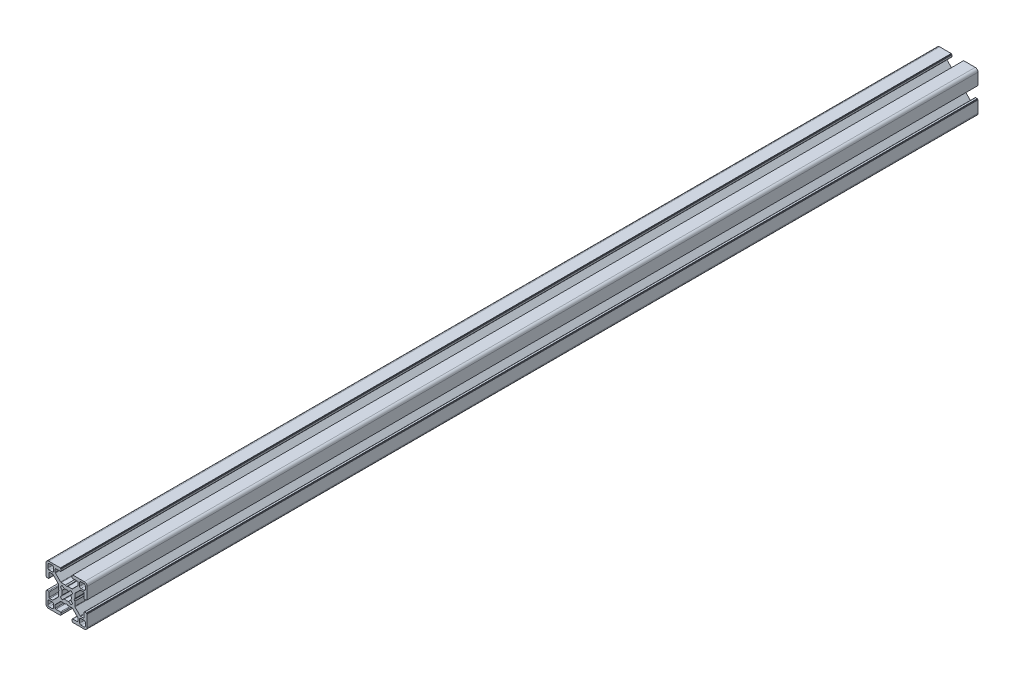
from build123d import *

# Parameters (mm, degrees)
BOSS_EXTRUDE1_DEPTH = 325
CIRPATTERN1_COUNT   = 4


with BuildPart() as part:
    # Sketch3 → Boss-Extrude1 (new, symmetric)
    with BuildSketch(Plane.XY):
        with BuildLine():
            Line((-4.503841895, 3.156803476), (-3.14772708, 1.530298739))
            ThreePointArc((-3.14772708, 1.530298739), (-3.410794979, 0.785160882), (-3.5, 0))
            Line((-3.5, 0), (-5.5, 0))
            Line((-5.5, 0), (-6, 0.866025404))
            Line((-6, 0.866025404), (-6, 3.996841995))
            ThreePointArc((-6, 3.996841995), (-6.038060234, 4.188183711), (-6.146446609, 4.350395385))
            Line((-6.146446609, 4.350395385), (-9.917104615, 8.121053391))
            ThreePointArc((-9.917104615, 8.121053391), (-10.079316289, 8.229439766), (-10.270658005, 8.2675))
            Line((-10.270658005, 8.2675), (-12.29, 8.2675))
            ThreePointArc((-12.29, 8.2675), (-12.643553391, 8.121053391), (-12.79, 7.7675))
            Line((-12.79, 7.7675), (-12.79, 4.5))
            ThreePointArc((-12.79, 4.5), (-12.936446609, 4.146446609), (-13.29, 4))
            Line((-13.29, 4), (-14.5, 4))
            Line((-14.5, 4), (-14.5, 4.5))
            Line((-14.5, 4.5), (-15, 4.5))
            Line((-15, 4.5), (-15, 12.968))
            ThreePointArc((-15, 12.968), (-14.404840979, 14.404840979), (-12.968, 15))
            Line((-12.968, 15), (-4.5, 15))
            Line((-4.5, 15), (-4.5, 14.5))
            Line((-4.5, 14.5), (-4, 14.5))
            Line((-4, 14.5), (-4, 13.29))
            ThreePointArc((-4, 13.29), (-4.146446609, 12.936446609), (-4.5, 12.79))
            Line((-4.5, 12.79), (-7.7675, 12.79))
            ThreePointArc((-7.7675, 12.79), (-8.121053391, 12.643553391), (-8.2675, 12.29))
            Line((-8.2675, 12.29), (-8.2675, 10.270658005))
            ThreePointArc((-8.2675, 10.270658005), (-8.229439766, 10.079316289), (-8.121053391, 9.917104615))
            Line((-8.121053391, 9.917104615), (-4.350395385, 6.146446609))
            ThreePointArc((-4.350395385, 6.146446609), (-4.188183711, 6.038060234), (-3.996841995, 6))
            Line((-3.996841995, 6), (-0.866025404, 6))
            Line((-0.866025404, 6), (0, 5.5))
            Line((0, 5.5), (0, 3.5))
            ThreePointArc((0, 3.5), (-0.785160882, 3.410794979), (-1.530298739, 3.14772708))
            Line((-1.530298739, 3.14772708), (-3.156803476, 4.503841895))
            ThreePointArc((-3.156803476, 4.503841895), (-3.889087297, 3.889087297), (-4.503841895, 3.156803476))
        make_face()
        with BuildLine():
            Line((-12.705, 9.5135), (-10.5135, 9.5135))
            ThreePointArc((-10.5135, 9.5135), (-9.806393219, 9.806393219), (-9.5135, 10.5135))
            Line((-9.5135, 10.5135), (-9.5135, 12.705))
            ThreePointArc((-9.5135, 12.705), (-9.806393219, 13.412106781), (-10.5135, 13.705))
            Line((-10.5135, 13.705), (-12.705, 13.705))
            ThreePointArc((-12.705, 13.705), (-13.412106781, 13.412106781), (-13.705, 12.705))
            Line((-13.705, 12.705), (-13.705, 10.5135))
            ThreePointArc((-13.705, 10.5135), (-13.412106781, 9.806393219), (-12.705, 9.5135))
        make_face(mode=Mode.SUBTRACT)
    boss_extrude1 = extrude(amount=BOSS_EXTRUDE1_DEPTH, both=True)

    # CirPattern1: Boss-Extrude1 ×4 about axis
    cirpattern1_axis = Axis((0, 0, 0), (0, 0, 1))
    for i in range(1, CIRPATTERN1_COUNT):
        add(boss_extrude1.rotate(cirpattern1_axis, i * 360 / CIRPATTERN1_COUNT))


solid = part.part
